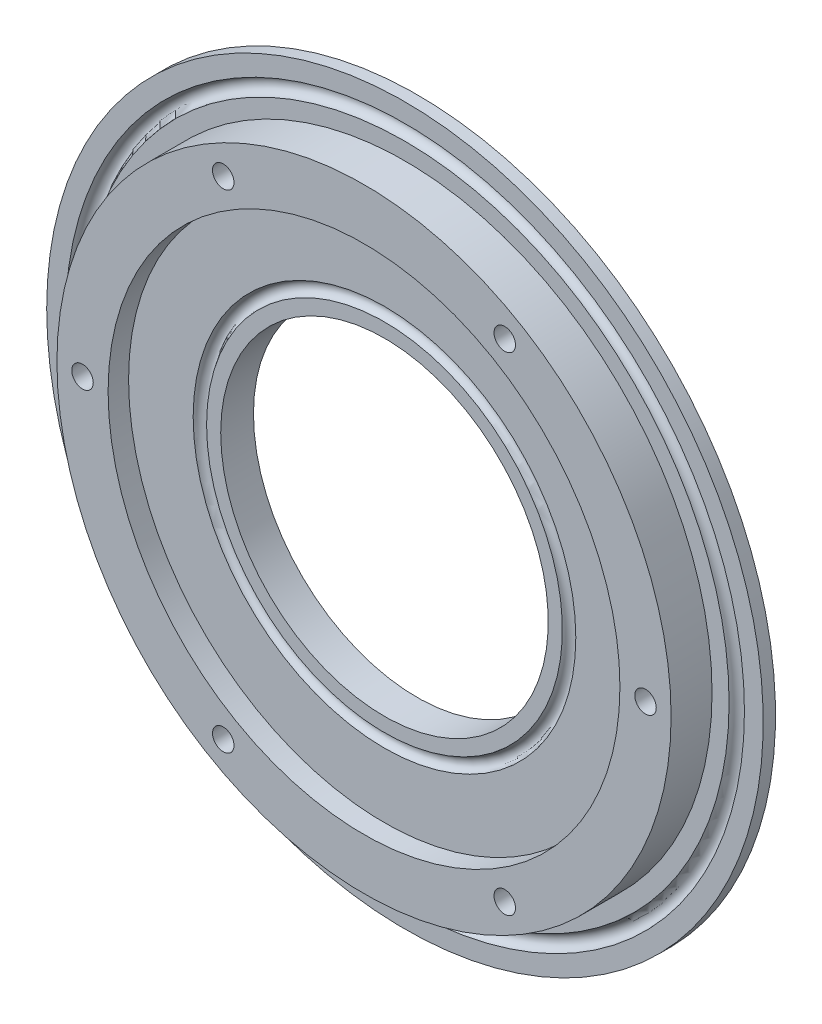
from build123d import *

# Parameters (mm, degrees)
BROCA_DE_ROSQUEAR_PARA_TARRAXA_DE_M5X0_8_D     = 4.2
BROCA_DE_ROSQUEAR_PARA_TARRAXA_DE_M5X0_8_DEPTH = 7
BROCA_DE_ROSQUEAR_PARA_TARRAXA_DE_M5X0_8_TIP   = 1.2618073


with BuildPart() as part:
    # Esboço2 → Revolução1 (revolve)
    with BuildSketch(Plane(origin=(0, 0, 0), x_dir=(1, 0, 0), z_dir=(0, 1, 0))):
        with BuildLine():
            Line((-66.33, 2), (-70, 2))
            Line((-70, 2), (-70, 4.4))
            Line((-70, 4.4), (-32, 4.4))
            Line((-32, 4.4), (-32, -2))
            Line((-32, -2), (-34.76, -2))
            ThreePointArc((-34.76, -2), (-36.07, -0.842172747), (-37.38, -2))
            Line((-37.38, -2), (-50, -2))
            Line((-50, -2), (-50, -6))
            Line((-50, -6), (-60, -6))
            Line((-60, -6), (-60, 2))
            Line((-60, 2), (-63.33, 2))
            ThreePointArc((-63.33, 2), (-64.83, 3.5), (-66.33, 2))
        make_face()
    revolve(axis=Axis((0, 0, -4.826033988), (0, 0, 1)))

    # Broca de rosquear para tarraxa de M5x0.81
    with Locations(Plane.XY.offset(6)):
        with Locations((-27.5, 47.631397208), (27.5, 47.631397208), (55, 0), (27.5, -47.631397208), (-27.5, -47.631397208), (-55, 0)):
            Hole(BROCA_DE_ROSQUEAR_PARA_TARRAXA_DE_M5X0_8_D / 2, depth=BROCA_DE_ROSQUEAR_PARA_TARRAXA_DE_M5X0_8_DEPTH)
            with Locations((0, 0, -(BROCA_DE_ROSQUEAR_PARA_TARRAXA_DE_M5X0_8_DEPTH + BROCA_DE_ROSQUEAR_PARA_TARRAXA_DE_M5X0_8_TIP / 2))):  # 118° drill point
                Cone(0, BROCA_DE_ROSQUEAR_PARA_TARRAXA_DE_M5X0_8_D / 2, BROCA_DE_ROSQUEAR_PARA_TARRAXA_DE_M5X0_8_TIP, mode=Mode.SUBTRACT)


solid = part.part
